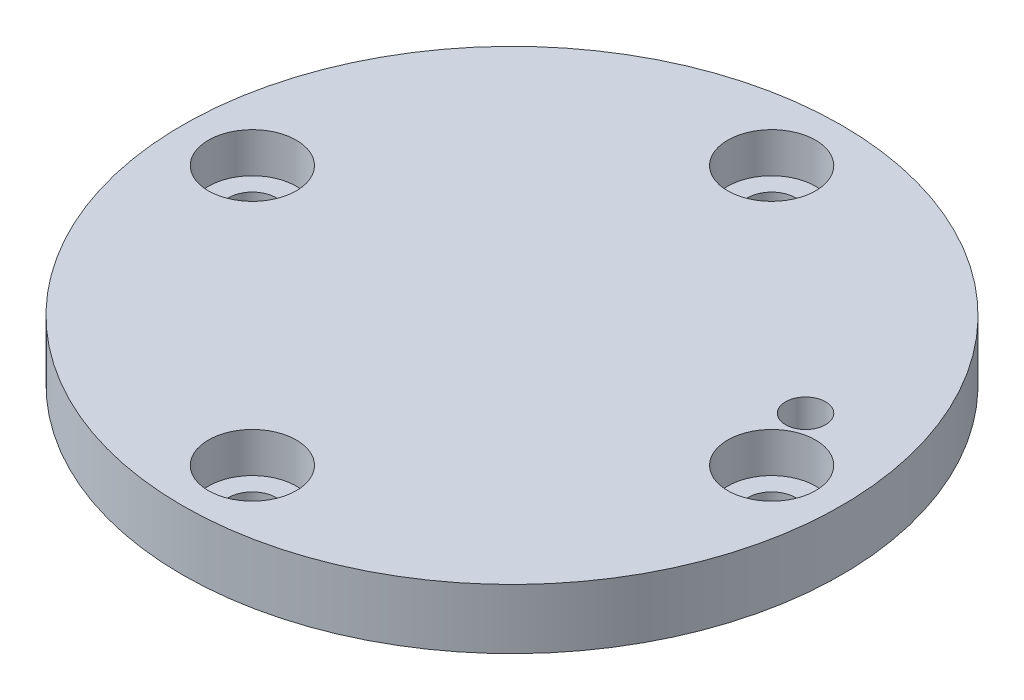
from build123d import *

# Parameters (mm, degrees)
SKETCH1_R                      = 16.5
BOSS_EXTRUDE1_DEPTH            = 3
CBORE_FOR_M2_SHCS1_D           = 2.4
CBORE_FOR_M2_SHCS1_CBORE_D     = 4.4
CBORE_FOR_M2_SHCS1_CBORE_DEPTH = 2
CIRPATTERN1_COUNT              = 4
SKETCH15_R                     = 0.5
CUT_EXTRUDE1_DEPTH             = 1.5
CUT_EXTRUDE2_DEPTH             = 24.526580712
CUT_EXTRUDE2_DEPTH_BACK        = 24.526580712
SKETCH16_R                     = 1


with BuildPart() as part:
    # Sketch1 → Boss-Extrude1 (new body)
    with BuildSketch(Plane(origin=(0, 0, 0), x_dir=(1, 0, 0), z_dir=(0, 1, 0))):
        with Locations(Location((0, 0, 0), (0, 0, 270))):
            Circle(SKETCH1_R)
    extrude(amount=BOSS_EXTRUDE1_DEPTH)

    # CBORE for M2 SHCS1 (through all)
    with Locations(Plane(origin=(0, 3, 0), x_dir=(1, 0, 0), z_dir=(0, 1, 0))):
        with Locations((-13, 0)):
            cbore_for_m2_shcs1 = CounterBoreHole(CBORE_FOR_M2_SHCS1_D / 2, CBORE_FOR_M2_SHCS1_CBORE_D / 2, CBORE_FOR_M2_SHCS1_CBORE_DEPTH)

    # CirPattern1: CBORE for M2 SHCS1 ×4 about axis
    cirpattern1_axis = Axis((0, 0, 0), (0, 1, 0))
    for i in range(1, CIRPATTERN1_COUNT):
        add(cbore_for_m2_shcs1.rotate(cirpattern1_axis, i * 360 / CIRPATTERN1_COUNT), mode=Mode.SUBTRACT)

    # Sketch15 → Cut-Extrude1 (cut)
    with BuildSketch(Plane.XZ):
        with Locations(Location((6, 0, 0), (0, 0, 270))):
            Circle(SKETCH15_R)
    extrude(amount=-CUT_EXTRUDE1_DEPTH, mode=Mode.SUBTRACT)

    # Sketch16 → Cut-Extrude2 (cut, two sides: drawn at the far end of the back side and taken through both)
    with BuildSketch(Plane(origin=(0, 3, 0), x_dir=(1, 0, 0), z_dir=(0, 1, 0)).offset(-CUT_EXTRUDE2_DEPTH_BACK)):
        with Locations(Location((11.591109915, 3.105828541, 0), (0, 0, 270))):
            Circle(SKETCH16_R)
    extrude(amount=CUT_EXTRUDE2_DEPTH + CUT_EXTRUDE2_DEPTH_BACK, mode=Mode.SUBTRACT)


solid = part.part
